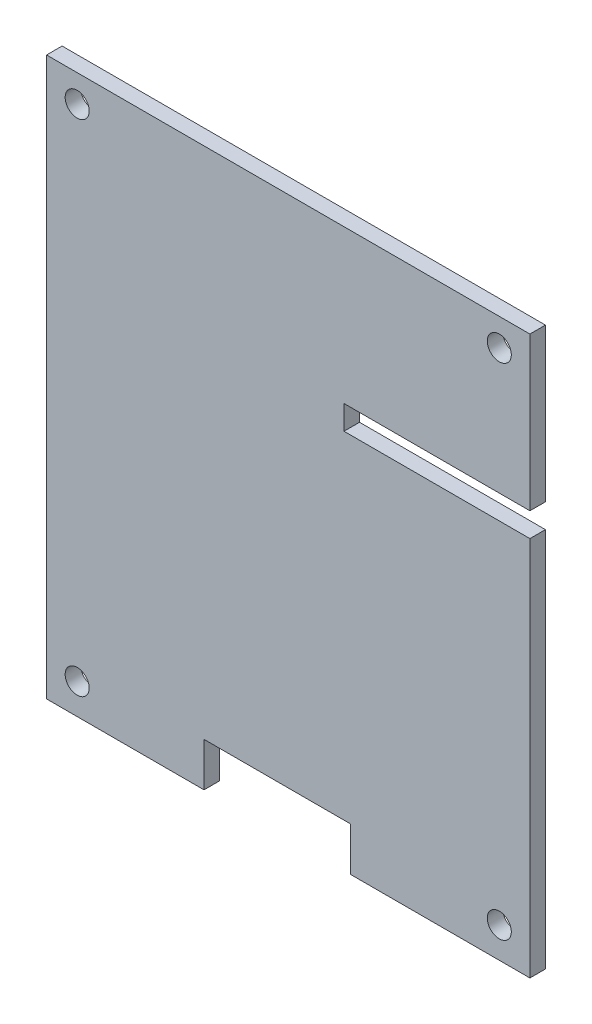
from build123d import *

# Parameters (mm, degrees)
SKETCH1_R           = 1.397
BOSS_EXTRUDE1_DEPTH = 1.8034


with BuildPart() as part:
    # Sketch1 → Boss-Extrude1 (new body)
    with BuildSketch(Plane.XY):
        Polygon((0, 64.77), (-56.134, 64.77), (-56.134, 0), (-37.846, 0), (-37.846, 5.08), (-20.828, 5.08), (-20.828, 0), (0, 0), (0, 44.196), (-21.59, 44.196), (-21.59, 46.99), (0, 46.99), align=None)
        with Locations((-52.578, 3.556)):
            Circle(SKETCH1_R, mode=Mode.SUBTRACT)
        with Locations((-3.556, 3.556)):
            Circle(SKETCH1_R, mode=Mode.SUBTRACT)
        with Locations((-52.578, 61.595)):
            Circle(SKETCH1_R, mode=Mode.SUBTRACT)
        with Locations((-3.556, 61.595)):
            Circle(SKETCH1_R, mode=Mode.SUBTRACT)
    extrude(amount=BOSS_EXTRUDE1_DEPTH)


solid = part.part
